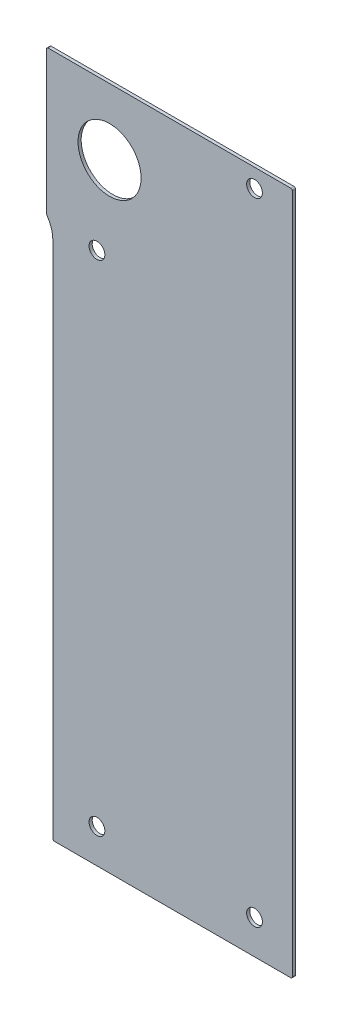
from build123d import *

# Parameters (mm, degrees)
SKETCH1_R           = 2.5
SKETCH1_R_2         = 10
BOSS_EXTRUDE1_DEPTH = 1
SKETCH2_R           = 1.5
CUT_EXTRUDE1_DEPTH  = 230.926075076
FILLET1_R           = 0.5
FILLET2_R           = 10
CUT_EXTRUDE2_DEPTH  = 10
FILLET3_R           = 2
FILLET4_R           = 0.5


with BuildPart() as part:
    # Sketch1 → Boss-Extrude1 (new body)
    with BuildSketch(Plane.XY):
        Polygon((0, 0), (76, 0), (76, 217), (-12.55, 217), (-12.55, 212), (-19.55, 212), (-19.55, 217), (-32, 217), (-32, 175), (0, 175), align=None)
        with Locations((14, 169.15)):
            Circle(SKETCH1_R, mode=Mode.SUBTRACT)
        with Locations((14, 10.85)):
            Circle(SKETCH1_R, mode=Mode.SUBTRACT)
        with Locations((64, 10.85)):
            Circle(SKETCH1_R, mode=Mode.SUBTRACT)
        with Locations((64, 211.15)):
            Circle(SKETCH1_R, mode=Mode.SUBTRACT)
        with Locations((18, 196)):
            Circle(SKETCH1_R_2, mode=Mode.SUBTRACT)
        with BuildLine():
            Line((-19.55, 207), (-12.55, 207))
            ThreePointArc((-12.55, 207), (-11.425, 205.875), (-12.55, 204.75))
            Line((-12.55, 204.75), (-19.55, 204.75))
            ThreePointArc((-19.55, 204.75), (-20.675, 205.875), (-19.55, 207))
        make_face(mode=Mode.SUBTRACT)
    extrude(amount=BOSS_EXTRUDE1_DEPTH)

    # Sketch2 → Cut-Extrude1 (cut, through all)
    with BuildSketch(Plane.XY.offset(1)):
        with Locations((-13.610660172, 213.060660172)):
            Circle(SKETCH2_R)
        with Locations((-18.489339828, 213.060660172)):
            Circle(SKETCH2_R)
    extrude(amount=-CUT_EXTRUDE1_DEPTH, mode=Mode.SUBTRACT)

    # Fillet1
    fillet1_edges = [part.edges().sort_by_distance(p)[0] for p in [
        (-32, 217, 0.5),
        (-19.55, 217, 0.5),
        (-12.55, 217, 0.5),
        (76, 217, 0.5),
        (76, 0, 0.5),
        (0, 0, 0.5),
    ]]
    fillet(fillet1_edges, radius=FILLET1_R)

    # Fillet2
    fillet2_edges = [part.edges().sort_by_distance(p)[0] for p in [
        (0, 175, 0.5),
        (-32, 175, 0.5),
    ]]
    fillet(fillet2_edges, radius=FILLET2_R)

    # Sketch4 → Cut-Extrude2 (cut)
    with BuildSketch(Plane.XY.offset(1)):
        with BuildLine():
            Line((-2, 217), (-2, 171))
            ThreePointArc((-2, 171), (-5.865545946, 173.268908108), (-10, 175))
            Line((-10, 175), (-22, 175))
            ThreePointArc((-22, 175), (-29.071067812, 177.928932188), (-32, 185))
            Line((-32, 185), (-32, 216.5))
            ThreePointArc((-32, 216.5), (-31.853553391, 216.853553391), (-31.5, 217))
            Line((-31.5, 217), (-20.05, 217))
            ThreePointArc((-20.05, 217), (-19.696446609, 216.853553391), (-19.55, 216.5))
            Line((-19.55, 216.5), (-19.55, 214.121320344))
            ThreePointArc((-19.55, 214.121320344), (-19.55, 212), (-17.428679656, 212))
            Line((-17.428679656, 212), (-14.671320344, 212))
            ThreePointArc((-14.671320344, 212), (-12.55, 212), (-12.55, 214.121320344))
            Line((-12.55, 214.121320344), (-12.55, 216.5))
            ThreePointArc((-12.55, 216.5), (-12.403553391, 216.853553391), (-12.05, 217))
            Line((-12.05, 217), (-2, 217))
        make_face()
    extrude(amount=-CUT_EXTRUDE2_DEPTH, mode=Mode.SUBTRACT)

    # Fillet3
    fillet3_edges = [part.edges().sort_by_distance(p)[0] for p in [
        (-2, 171, 0.5),
    ]]
    fillet(fillet3_edges, radius=FILLET3_R)

    # Fillet4
    fillet4_edges = [part.edges().sort_by_distance(p)[0] for p in [
        (-2, 217, 0.5),
    ]]
    fillet(fillet4_edges, radius=FILLET4_R)


solid = part.part
